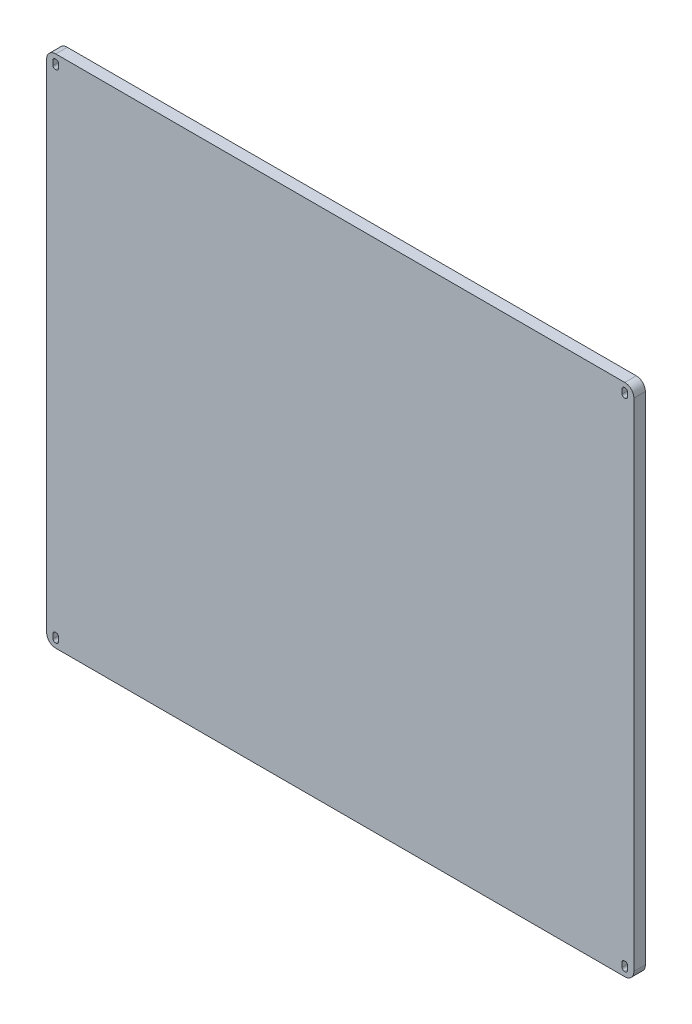
from build123d import *

# Parameters (mm, degrees)
SKETCH1_W           = 647.7
SKETCH1_H           = 567.69
BOSS_EXTRUDE1_DEPTH = 12.7
FILLET1_R           = 10


with BuildPart() as part:
    # Sketch1 → Boss-Extrude1 (new body)
    with BuildSketch(Plane.XY):
        with Locations((-14.097734139, -156.072190332)):
            Rectangle(SKETCH1_W, SKETCH1_H)
        with BuildLine():
            Line((300.252265861, -434.917190332), (299.252265861, -434.917190332))
            ThreePointArc((299.252265861, -434.917190332), (297.484498908, -434.184957285), (296.752265861, -432.417190332))
            Line((296.752265861, -432.417190332), (296.752265861, -427.417190332))
            ThreePointArc((296.752265861, -427.417190332), (297.484498908, -425.649423379), (299.252265861, -424.917190332))
            Line((299.252265861, -424.917190332), (300.252265861, -424.917190332))
            ThreePointArc((300.252265861, -424.917190332), (302.020032814, -425.649423379), (302.752265861, -427.417190332))
            Line((302.752265861, -427.417190332), (302.752265861, -432.417190332))
            ThreePointArc((302.752265861, -432.417190332), (302.020032814, -434.184957285), (300.252265861, -434.917190332))
        make_face(mode=Mode.SUBTRACT)
        with BuildLine():
            Line((-327.447734139, -434.917190332), (-328.447734139, -434.917190332))
            ThreePointArc((-328.447734139, -434.917190332), (-330.215501092, -434.184957285), (-330.947734139, -432.417190332))
            Line((-330.947734139, -432.417190332), (-330.947734139, -427.417190332))
            ThreePointArc((-330.947734139, -427.417190332), (-330.215501092, -425.649423379), (-328.447734139, -424.917190332))
            Line((-328.447734139, -424.917190332), (-327.447734139, -424.917190332))
            ThreePointArc((-327.447734139, -424.917190332), (-325.679967186, -425.649423379), (-324.947734139, -427.417190332))
            Line((-324.947734139, -427.417190332), (-324.947734139, -432.417190332))
            ThreePointArc((-324.947734139, -432.417190332), (-325.679967186, -434.184957285), (-327.447734139, -434.917190332))
        make_face(mode=Mode.SUBTRACT)
        with BuildLine():
            Line((-327.447734139, 112.772809668), (-328.447734139, 112.772809668))
            ThreePointArc((-328.447734139, 112.772809668), (-330.215501092, 113.505042715), (-330.947734139, 115.272809668))
            Line((-330.947734139, 115.272809668), (-330.947734139, 120.272809668))
            ThreePointArc((-330.947734139, 120.272809668), (-330.215501092, 122.040576621), (-328.447734139, 122.772809668))
            Line((-328.447734139, 122.772809668), (-327.447734139, 122.772809668))
            ThreePointArc((-327.447734139, 122.772809668), (-325.679967186, 122.040576621), (-324.947734139, 120.272809668))
            Line((-324.947734139, 120.272809668), (-324.947734139, 115.272809668))
            ThreePointArc((-324.947734139, 115.272809668), (-325.679967186, 113.505042715), (-327.447734139, 112.772809668))
        make_face(mode=Mode.SUBTRACT)
        with BuildLine():
            Line((300.252265861, 112.772809668), (299.252265861, 112.772809668))
            ThreePointArc((299.252265861, 112.772809668), (297.484498908, 113.505042715), (296.752265861, 115.272809668))
            Line((296.752265861, 115.272809668), (296.752265861, 120.272809668))
            ThreePointArc((296.752265861, 120.272809668), (297.484498908, 122.040576621), (299.252265861, 122.772809668))
            Line((299.252265861, 122.772809668), (300.252265861, 122.772809668))
            ThreePointArc((300.252265861, 122.772809668), (302.020032814, 122.040576621), (302.752265861, 120.272809668))
            Line((302.752265861, 120.272809668), (302.752265861, 115.272809668))
            ThreePointArc((302.752265861, 115.272809668), (302.020032814, 113.505042715), (300.252265861, 112.772809668))
        make_face(mode=Mode.SUBTRACT)
    extrude(amount=BOSS_EXTRUDE1_DEPTH)

    # Fillet1
    fillet1_edges = [part.edges().sort_by_distance(p)[0] for p in [
        (-337.947734139, 127.772809668, 6.35),
        (309.752265861, 127.772809668, 6.35),
        (309.752265861, -439.917190332, 6.35),
        (-337.947734139, -439.917190332, 6.35),
    ]]
    fillet(fillet1_edges, radius=FILLET1_R)


solid = part.part
